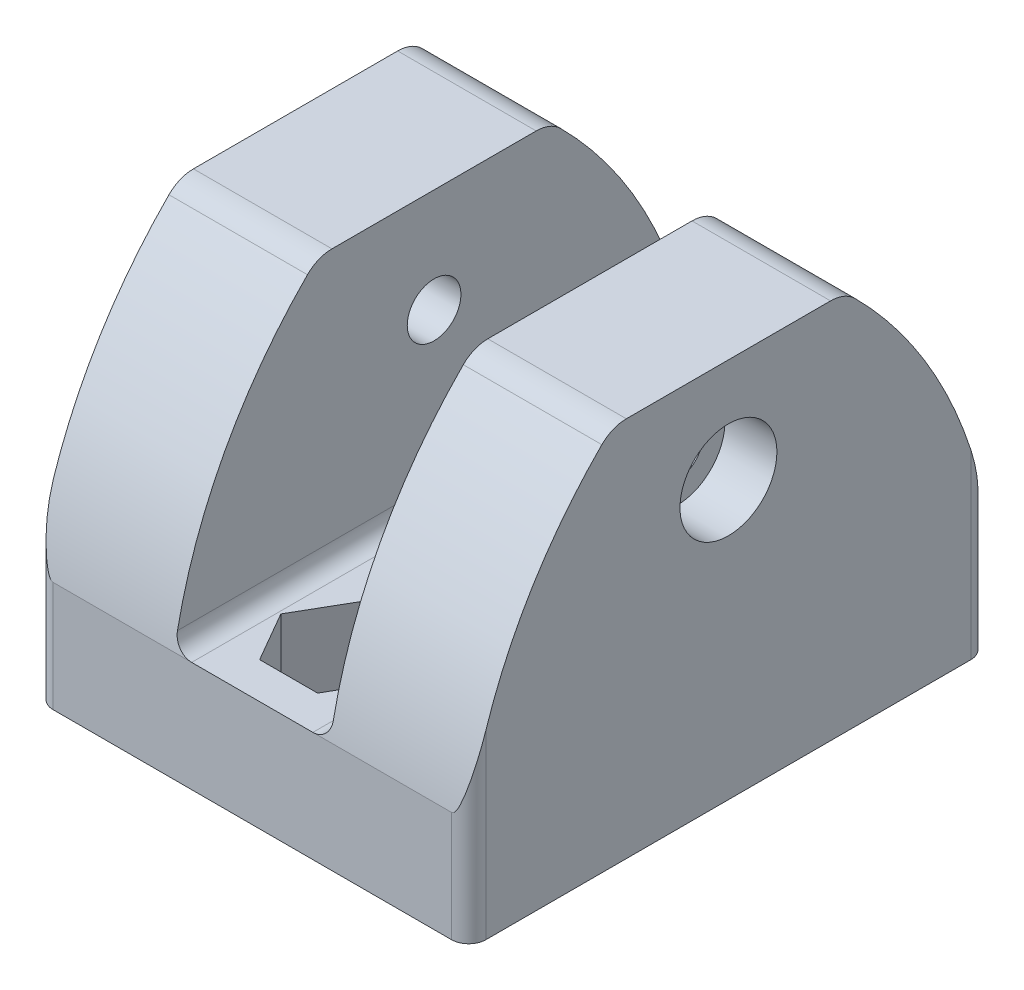
from build123d import *

# Parameters (mm, degrees)
CROQUIS1_W              = 25
CROQUIS1_H              = 30
CROQUIS1_R              = 1.55
SALIENTE_EXTRUIR1_DEPTH = 22
CORTAR_EXTRUIR1_REACH   = 46.822
CROQUIS2_W              = 9
CROQUIS2_H              = 15.632666969
CORTAR_EXTRUIR2_REACH   = 46.822
CROQUIS3_R              = 1.55
CORTAR_EXTRUIR3_DEPTH   = 2.5
CROQUIS5_R              = 2.8
CORTAR_EXTRUIR4_DEPTH   = 3
CORTAR_EXTRUIR5_DEPTH   = 4.5
CORTAR_EXTRUIR6_REACH   = 46.822
REDONDEO1_R             = 2
REDONDEO2_R             = 1
REDONDEO3_R             = 1


with BuildPart() as part:
    # Croquis1 → Saliente-Extruir1 (new body)
    with BuildSketch(Plane(origin=(0, 0, 0), x_dir=(1, 0, 0), z_dir=(0, 1, 0))):
        with Locations((12.5, 15)):
            Rectangle(CROQUIS1_W, CROQUIS1_H)
        with Locations(Location((12.5, 25, 0), (0, 0, 270))):
            Circle(CROQUIS1_R, mode=Mode.SUBTRACT)
        with Locations(Location((12.5, 5, 0), (0, 0, 270))):
            Circle(CROQUIS1_R, mode=Mode.SUBTRACT)
    extrude(amount=SALIENTE_EXTRUIR1_DEPTH)

    # Cortar-Extruir1: up to this face of the body (flat: up to its plane)
    cortar_extruir1_end = Plane(part.part.faces().sort_by_distance((12.5, 11, 0))[0])
    # Croquis2 → Cortar-Extruir1 (cut, up to the picked face)
    with BuildSketch(Plane(origin=(0, 0, -30), x_dir=(-1, 0, 0), z_dir=(0, 0, -1)), mode=Mode.PRIVATE) as cortar_extruir1_sk1:
        with Locations((-12.5, 14.183666516)):
            Rectangle(CROQUIS2_W, CROQUIS2_H)
    cortar_extruir1_tool1 = split(extrude(cortar_extruir1_sk1.sketch, amount=-CORTAR_EXTRUIR1_REACH, mode=Mode.PRIVATE), bisect_by=cortar_extruir1_end, keep=Keep.BOTH, mode=Mode.PRIVATE)
    add(cortar_extruir1_tool1.solids().sort_by(Axis((12.5, 14.183667, -30), (0, 0, 1)))[0], mode=Mode.SUBTRACT)

    # Cortar-Extruir2: up to this face of the body (flat: up to its plane)
    cortar_extruir2_end = Plane(part.part.faces().sort_by_distance((25, 11, -15))[0])
    # Croquis3 → Cortar-Extruir2 (cut, up to the picked face)
    with BuildSketch(Plane.ZY, mode=Mode.PRIVATE) as cortar_extruir2_sk1:
        with Locations((-15, 16)):
            Circle(CROQUIS3_R)
    cortar_extruir2_tool1 = split(extrude(cortar_extruir2_sk1.sketch, amount=-CORTAR_EXTRUIR2_REACH, mode=Mode.PRIVATE), bisect_by=cortar_extruir2_end, keep=Keep.BOTH, mode=Mode.PRIVATE)
    add(cortar_extruir2_tool1.solids().sort_by(Axis((0, 16, -15), (1, 0, 0)))[0], mode=Mode.SUBTRACT)

    # Croquis4 → Cortar-Extruir3 (cut)
    with BuildSketch(Plane.ZY):
        Polygon((-14.967896351, 19.348477667), (-17.8838149, 17.702041409), (-17.915918548, 14.353563741), (-15.032103649, 12.651522333), (-12.1161851, 14.297958591), (-12.084081452, 17.646436259), align=None)
    extrude(amount=-CORTAR_EXTRUIR3_DEPTH, mode=Mode.SUBTRACT)

    # Croquis5 → Cortar-Extruir4 (cut)
    with BuildSketch(Plane(origin=(25, 0, 0), x_dir=(0, 0, -1), z_dir=(1, 0, 0))):
        with Locations((15, 16)):
            Circle(CROQUIS5_R)
    extrude(amount=-CORTAR_EXTRUIR4_DEPTH, mode=Mode.SUBTRACT)

    # Croquis6 → Cortar-Extruir5 (cut)
    with BuildSketch(Plane(origin=(0, 6.367333031, 0), x_dir=(1, 0, 0), z_dir=(0, 1, 0))):
        Polygon((15.848631561, 25), (14.174315781, 27.9), (10.825684219, 27.9), (9.151368439, 25), (10.825684219, 22.1), (14.174315781, 22.1), align=None)
        Polygon((15.848631561, 5), (14.174315781, 7.9), (10.825684219, 7.9), (9.151368439, 5), (10.825684219, 2.1), (14.174315781, 2.1), align=None)
    extrude(amount=-CORTAR_EXTRUIR5_DEPTH, mode=Mode.SUBTRACT)

    # Cortar-Extruir6: up to this face of the body (flat: up to its plane)
    cortar_extruir6_end = Plane(part.part.faces().sort_by_distance((25, 10.806175223, -15))[0])
    # Croquis7 → Cortar-Extruir6 (cut, up to the picked face)
    with BuildSketch(Plane.ZY, mode=Mode.PRIVATE) as cortar_extruir6_sk1:
        with BuildLine():
            Line((-21.708203932, 22), (-30, 22))
            Line((-30, 22), (-30, 6.37))
            ThreePointArc((-30, 6.37), (-27.145099003, 14.869880624), (-21.708203932, 22))
        make_face()
    cortar_extruir6_tool1 = split(extrude(cortar_extruir6_sk1.sketch, amount=-CORTAR_EXTRUIR6_REACH, mode=Mode.PRIVATE), bisect_by=cortar_extruir6_end, keep=Keep.BOTH, mode=Mode.PRIVATE)
    # Croquis7 → Cortar-Extruir6 (cut, up to the picked face)
    with BuildSketch(Plane.ZY, mode=Mode.PRIVATE) as cortar_extruir6_sk2:
        with BuildLine():
            Line((0, 22), (-8.291796068, 22))
            ThreePointArc((-8.291796068, 22), (-2.854900997, 14.869880624), (0, 6.37))
            Line((0, 6.37), (0, 22))
        make_face()
    cortar_extruir6_tool2 = split(extrude(cortar_extruir6_sk2.sketch, amount=-CORTAR_EXTRUIR6_REACH, mode=Mode.PRIVATE), bisect_by=cortar_extruir6_end, keep=Keep.BOTH, mode=Mode.PRIVATE)
    add(cortar_extruir6_tool1.solids().sort_by(Axis((0, 17.640887, -27.55167), (1, 0, 0)))[0], mode=Mode.SUBTRACT)
    add(cortar_extruir6_tool2.solids().sort_by(Axis((0, 17.640887, -2.44833), (1, 0, 0)))[0], mode=Mode.SUBTRACT)

    # Redondeo1
    redondeo1_edges = [part.edges().sort_by_distance(p)[0] for p in [
        (4, 22, -21.708203932),
        (21, 22, -21.708203932),
        (4, 22, -8.291796068),
        (21, 22, -8.291796068),
    ]]
    fillet(redondeo1_edges, radius=REDONDEO1_R)

    # Redondeo2
    redondeo2_edges = [part.edges().sort_by_distance(p)[0] for p in [
        (17, 6.367333031, -15),
        (8, 6.367333031, -15),
    ]]
    fillet(redondeo2_edges, radius=REDONDEO2_R)

    # Redondeo3
    redondeo3_edges = [part.edges().sort_by_distance(p)[0] for p in [
        (25, 3.185, -30),
        (0, 3.185, -30),
        (25, 3.185, 0),
        (0, 3.185, 0),
    ]]
    fillet(redondeo3_edges, radius=REDONDEO3_R)


solid = part.part
